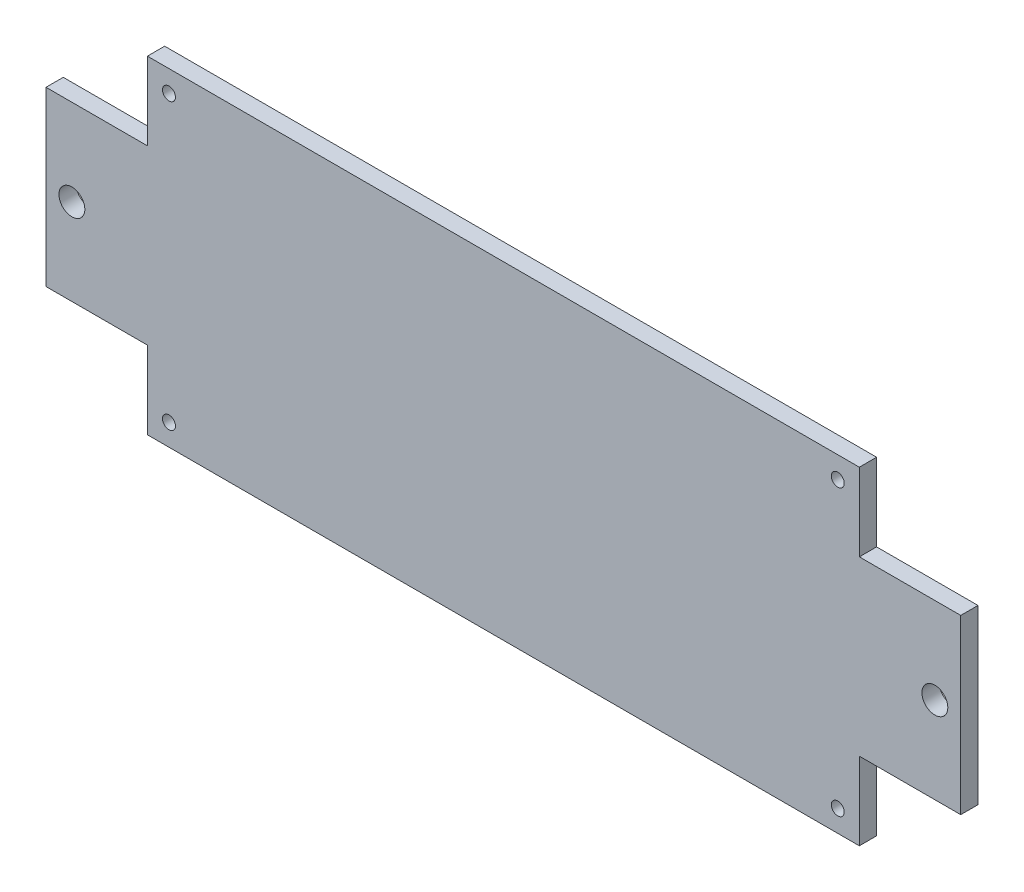
from build123d import *

# Parameters (mm, degrees)
SKETCH1_R           = 1.5
SKETCH1_R_2         = 3
BOSS_EXTRUDE1_DEPTH = 4


with BuildPart() as part:
    # Sketch1 → Boss-Extrude1 (new body)
    with BuildSketch(Plane.XY):
        Polygon((16.544913582, 45.848229773), (181.544913582, 45.848229773), (181.544913582, 27.848229773), (205.044913582, 27.848229773), (205.044913582, -12.151770227), (181.544913582, -12.151770227), (181.544913582, -30.151770227), (16.544913582, -30.151770227), (16.544913582, -12.151770227), (-6.955086418, -12.151770227), (-6.955086418, 27.848229773), (16.544913582, 27.848229773), align=None)
        with Locations((21.544913582, -25.151770227)):
            Circle(SKETCH1_R, mode=Mode.SUBTRACT)
        with Locations(Location((176.544913582, -25.151770227, 0), (0, 0, 180))):
            Circle(SKETCH1_R, mode=Mode.SUBTRACT)
        with Locations((176.544913582, 40.848229773)):
            Circle(SKETCH1_R, mode=Mode.SUBTRACT)
        with Locations(Location((21.544913582, 40.848229773, 0), (0, 0, 180))):
            Circle(SKETCH1_R, mode=Mode.SUBTRACT)
        with Locations((199.044913582, 7.848229773)):
            Circle(SKETCH1_R_2, mode=Mode.SUBTRACT)
        with Locations(Location((-0.955086418, 7.848229773, 0), (0, 0, 180))):
            Circle(SKETCH1_R_2, mode=Mode.SUBTRACT)
    extrude(amount=BOSS_EXTRUDE1_DEPTH)


solid = part.part
